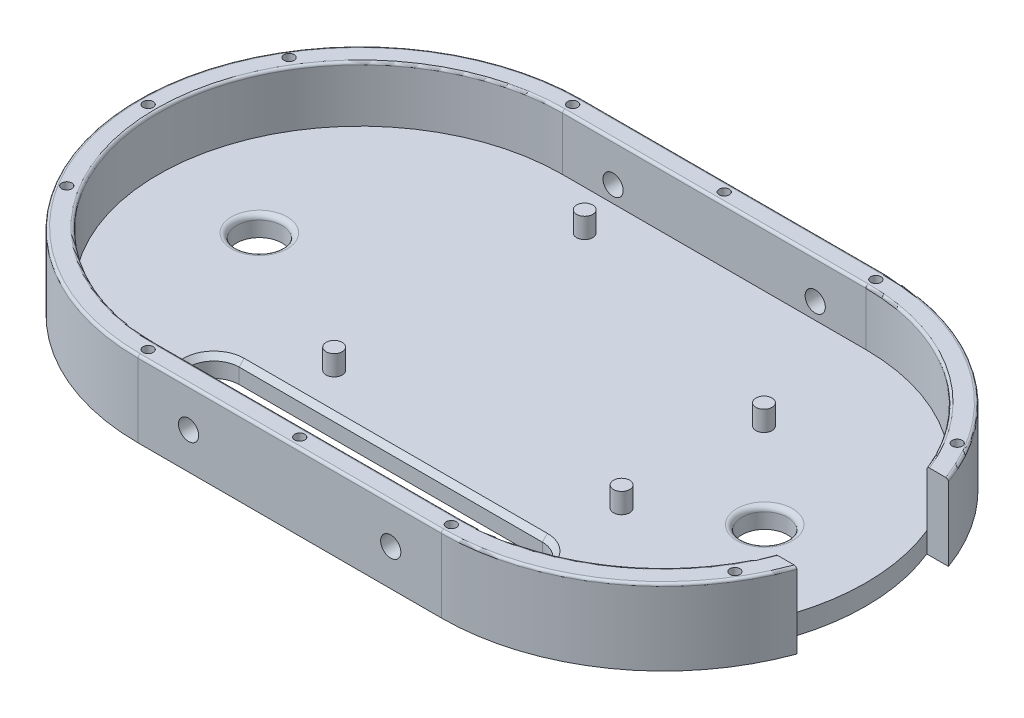
from build123d import *

# Parameters (mm, degrees)
BOSS_EXTRUDE1_DEPTH = 15
SHELL1_T            = -4
CUT_EXTRUDE1_DEPTH  = 15
SKETCH3_R           = 1
CUT_EXTRUDE2_DEPTH  = 6
FILLET1_R           = 0.5
SKETCH4_R           = 2
CUT_EXTRUDE3_DEPTH  = 116.95257659
CHAMFER1_SIZE       = 1
CUT_EXTRUDE7_DEPTH  = 88.389930872
SKETCH9_R           = 1.6
BOSS_EXTRUDE3_DEPTH = 4
SKETCH10_R          = 4.5
CUT_EXTRUDE8_DEPTH  = 10
FILLET2_R           = 1


with BuildPart() as part:
    # Sketch1 → Boss-Extrude1 (new body)
    with BuildSketch(Plane(origin=(0, 0, 0), x_dir=(1, 0, 0), z_dir=(0, 1, 0))):
        with BuildLine():
            Line((-30, 44), (30, 44))
            ThreePointArc((30, 44), (74, 0), (30, -44))
            Line((30, -44), (-30, -44))
            ThreePointArc((-30, -44), (-74, 0), (-30, 44))
        make_face()
    extrude(amount=BOSS_EXTRUDE1_DEPTH)

    # Shell1
    shell1_openings = [part.faces().sort_by_distance(p)[0] for p in [
        (0, 15, 0),
    ]]
    offset(amount=SHELL1_T, openings=shell1_openings, kind=Kind.INTERSECTION)

    # Sketch2 → Cut-Extrude1 (cut)
    with BuildSketch(Plane(origin=(0, 4, 0), x_dir=(1, 0, 0), z_dir=(0, 1, 0))):
        with BuildLine():
            Line((-30, -24), (30, -24))
            ThreePointArc((30, -24), (35, -29), (30, -34))
            Line((30, -34), (-30, -34))
            ThreePointArc((-30, -34), (-35, -29), (-30, -24))
        make_face()
    extrude(amount=-CUT_EXTRUDE1_DEPTH, mode=Mode.SUBTRACT)

    # Sketch3 → Cut-Extrude2 (cut)
    with BuildSketch(Plane(origin=(0, 15, 0), x_dir=(1, 0, 0), z_dir=(0, 1, 0))):
        with Locations(Location((-30, -42, 0), (0, 0, 270))):
            Circle(SKETCH3_R)
        with Locations(Location((0, -42, 0), (0, 0, 270))):
            Circle(SKETCH3_R)
        with Locations(Location((30, -42, 0), (0, 0, 270))):
            Circle(SKETCH3_R)
        with Locations(Location((-30, 42, 0), (0, 0, 270))):
            Circle(SKETCH3_R)
        with Locations(Location((0, 42, 0), (0, 0, 270))):
            Circle(SKETCH3_R)
        with Locations(Location((30, 42, 0), (0, 0, 270))):
            Circle(SKETCH3_R)
        with Locations(Location((66.105117767, 22, 0), (0, 0, 270))):
            Circle(SKETCH3_R)
        with Locations(Location((72, 0, 0), (0, 0, 270))):
            Circle(SKETCH3_R)
        with Locations(Location((-66.105117767, 22, 0), (0, 0, 270))):
            Circle(SKETCH3_R)
        with Locations(Location((-72, 0, 0), (0, 0, 270))):
            Circle(SKETCH3_R)
        with Locations(Location((-66.105117767, -22, 0), (0, 0, 270))):
            Circle(SKETCH3_R)
        with Locations(Location((66.105117767, -22, 0), (0, 0, 270))):
            Circle(SKETCH3_R)
    extrude(amount=-CUT_EXTRUDE2_DEPTH, mode=Mode.SUBTRACT)

    # Fillet1
    fillet1_edges = [part.edges().sort_by_distance(p)[0] for p in [
        (-74, 15, 0),
        (70, 15, 0),
        (0, 15, -40),
        (-70, 15, 0),
        (0, 15, 44),
        (0, 15, 40),
        (74, 15, 0),
        (0, 15, -44),
    ]]
    fillet(fillet1_edges, radius=FILLET1_R)

    # Sketch4 → Cut-Extrude3 (cut, through all)
    with BuildSketch(Plane.XY.offset(44)):
        with Locations((-20, 7.25)):
            Circle(SKETCH4_R)
        with Locations(Location((20, 7.25, 0), (0, 0, 180))):
            Circle(SKETCH4_R)
    extrude(amount=-CUT_EXTRUDE3_DEPTH, mode=Mode.SUBTRACT)

    # Chamfer1
    chamfer1_edges = [part.edges().sort_by_distance(p)[0] for p in [
        (-35, 4, 29),
        (0, 4, 34),
        (35, 4, 29),
        (0, 4, 24),
    ]]
    chamfer(chamfer1_edges, length=CHAMFER1_SIZE)

    # Sketch6 → Cut-Extrude7 (cut, through all)
    with BuildSketch(Plane(origin=(0, 0, 0), x_dir=(1, 0, 0), z_dir=(0, 1, 0))):
        with BuildLine():
            Line((83, 15), (67.080992435, 15))
            ThreePointArc((67.080992435, 15), (70, 0), (67.080992435, -15))
            Line((67.080992435, -15), (83, -15))
            Line((83, -15), (83, 15))
        make_face()
    extrude(amount=CUT_EXTRUDE7_DEPTH, mode=Mode.SUBTRACT)

    # Sketch9 → Boss-Extrude3 (add)
    with BuildSketch(Plane(origin=(0, 4, 0), x_dir=(1, 0, 0), z_dir=(0, 1, 0))):
        with Locations(Location((33.03, 16.83, 0), (0, 0, 270))):
            Circle(SKETCH9_R)
        with Locations(Location((33.03, -11.34, 0), (0, 0, 270))):
            Circle(SKETCH9_R)
        with Locations(Location((-17.78, 32.16, 0), (0, 0, 270))):
            Circle(SKETCH9_R)
        with Locations(Location((-19.03, -16.16, 0), (0, 0, 270))):
            Circle(SKETCH9_R)
    extrude(amount=BOSS_EXTRUDE3_DEPTH)

    # Sketch10 → Cut-Extrude8 (cut)
    with BuildSketch(Plane(origin=(0, 4, 0), x_dir=(1, 0, 0), z_dir=(0, 1, 0))):
        with Locations(Location((50, 0, 0), (0, 0, 270))):
            Circle(SKETCH10_R)
        with Locations(Location((-50, 0, 0), (0, 0, 270))):
            Circle(SKETCH10_R)
    extrude(amount=-CUT_EXTRUDE8_DEPTH, mode=Mode.SUBTRACT)

    # Fillet2
    fillet2_edges = [part.edges().sort_by_distance(p)[0] for p in [
        (50, 4, -4.5),
        (-50, 4, -4.5),
    ]]
    fillet(fillet2_edges, radius=FILLET2_R)


solid = part.part
